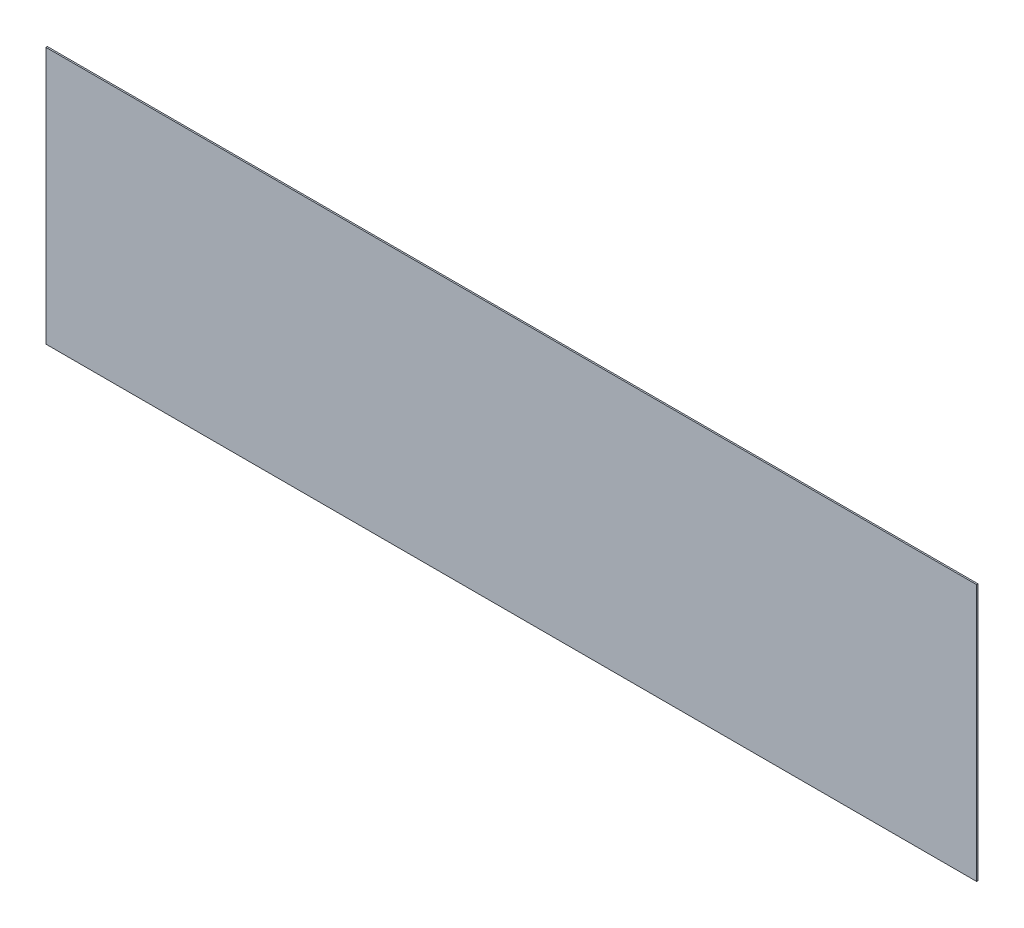
from build123d import *

# Parameters (mm, degrees)
DET2_ARKA_IC_SAC_1_START = -757.5
SKETCH1_W                = 648
SKETCH1_H                = 179
DET2_ARKA_IC_SAC_1_DEPTH = 1


with BuildPart() as part:
    # Sketch1 → DET2_arka_ic_sac_1 (new body)
    with BuildSketch(Plane.XY.offset(DET2_ARKA_IC_SAC_1_START)):
        with Locations((1026, 1558.5)):
            Rectangle(SKETCH1_W, SKETCH1_H)
    extrude(amount=-DET2_ARKA_IC_SAC_1_DEPTH)


solid = part.part
